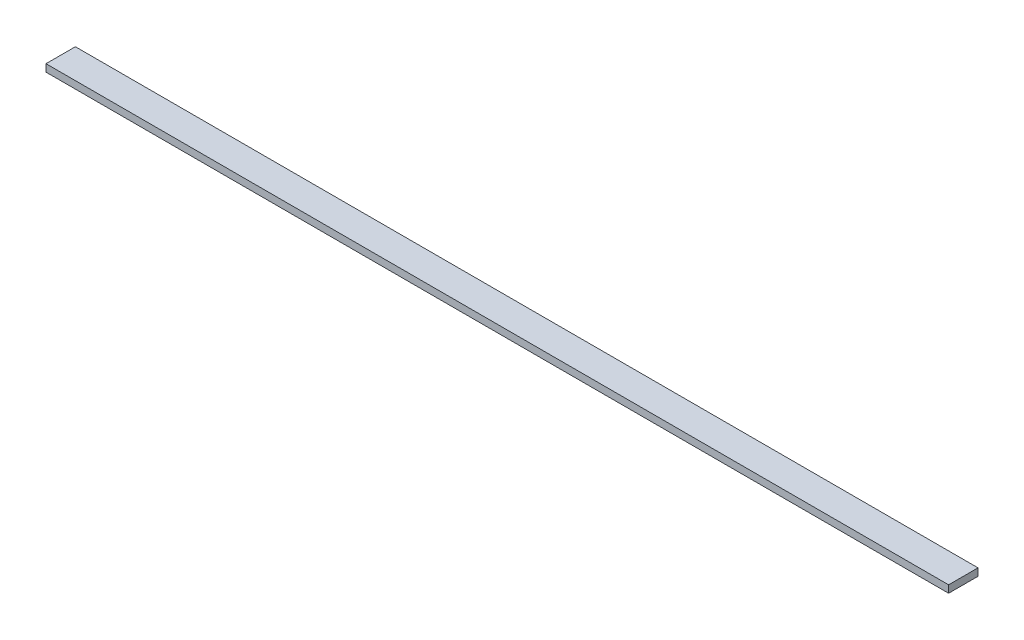
from build123d import *

# Parameters (mm, degrees)
SKETCH1_W           = 19.05
SKETCH1_H           = 4.7625
BOSS_EXTRUDE1_DEPTH = 292.55


with BuildPart() as part:
    # Sketch1 → Boss-Extrude1 (new, symmetric)
    with BuildSketch(Plane(origin=(0, 0, 0), x_dir=(0, 0, -1), z_dir=(1, 0, 0))):
        Rectangle(SKETCH1_W, SKETCH1_H)
    extrude(amount=BOSS_EXTRUDE1_DEPTH, both=True)


solid = part.part
